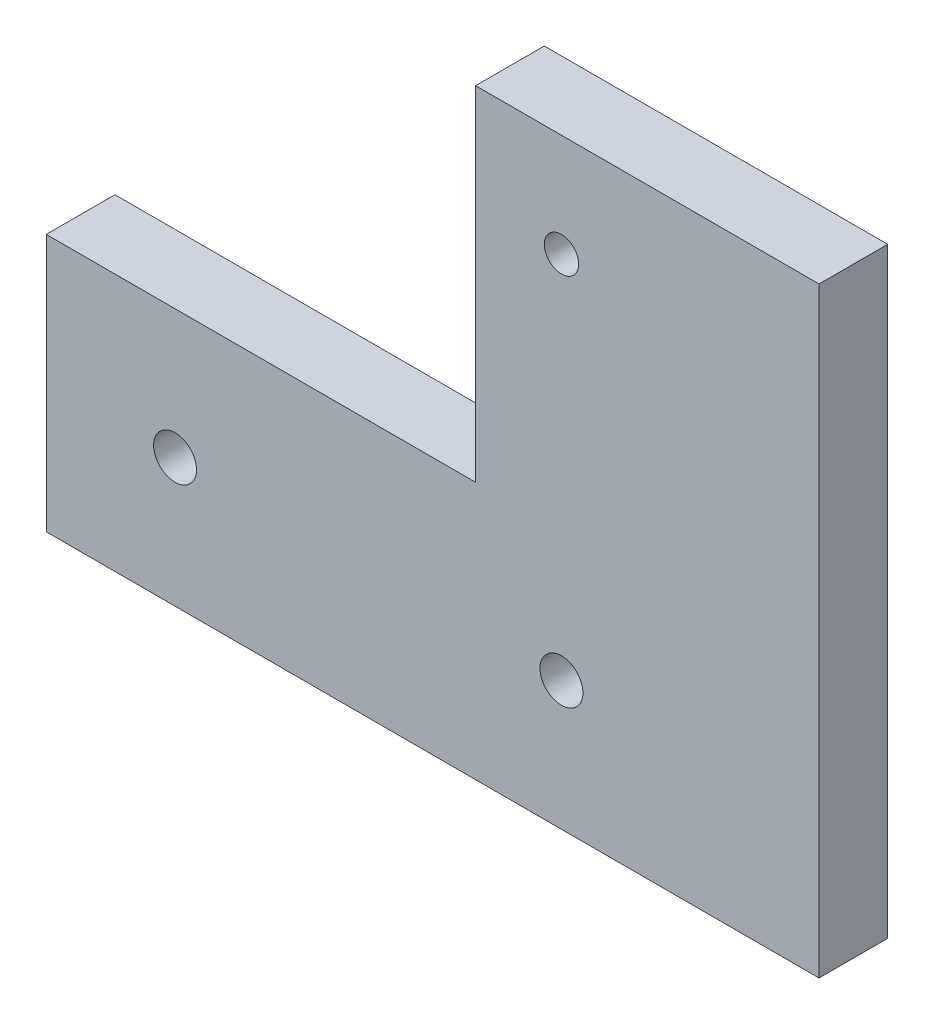
from build123d import *

# Parameters (mm, degrees)
SKETCH1_R           = 2.5
BOSS_EXTRUDE1_DEPTH = 8
SKETCH2_R           = 7.5
CUT_EXTRUDE1_DEPTH  = 5
SKETCH3_R           = 2
CUT_EXTRUDE2_DEPTH  = 114.791165634


with BuildPart() as part:
    # Sketch1 → Boss-Extrude1 (new body)
    with BuildSketch(Plane.XY):
        Polygon((-50.724939449, 17.294061535), (-10.724939449, 17.294061535), (-10.724939449, -52.705938465), (-100.724939449, -52.705938465), (-100.724939449, -22.705938465), (-50.724939449, -22.705938465), align=None)
        with Locations((-85.724939449, -37.705938465)):
            Circle(SKETCH1_R, mode=Mode.SUBTRACT)
        with Locations((-40.724939449, -37.705938465)):
            Circle(SKETCH1_R, mode=Mode.SUBTRACT)
    extrude(amount=BOSS_EXTRUDE1_DEPTH)

    # Sketch2 → Cut-Extrude1 (cut)
    with BuildSketch(Plane(origin=(0, 0, 0), x_dir=(-1, 0, 0), z_dir=(0, 0, -1))):
        with Locations((40.724939449, 5.294061535)):
            Circle(SKETCH2_R)
    extrude(amount=-CUT_EXTRUDE1_DEPTH, mode=Mode.SUBTRACT)

    # Sketch3 → Cut-Extrude2 (cut, through all)
    with BuildSketch(Plane(origin=(0, 0, 5), x_dir=(-1, 0, 0), z_dir=(0, 0, -1))):
        with Locations((40.724939449, 5.294061535)):
            Circle(SKETCH3_R)
    extrude(amount=-CUT_EXTRUDE2_DEPTH, mode=Mode.SUBTRACT)


solid = part.part
